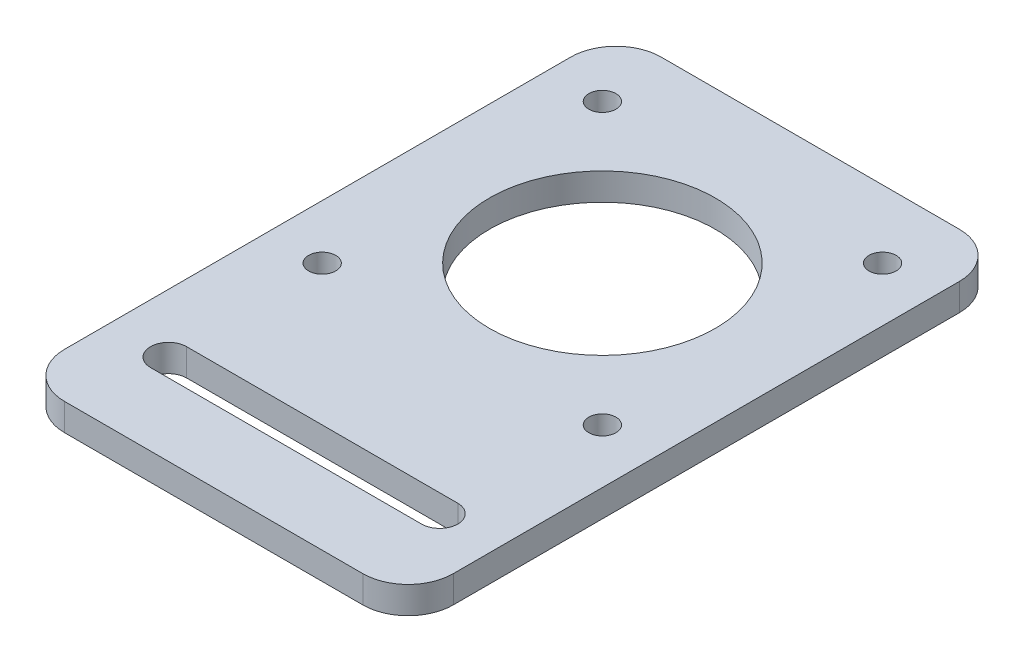
from build123d import *

# Parameters (mm, degrees)
SKETCH1_W           = 43
SKETCH1_H           = 66
BOSS_EXTRUDE1_DEPTH = 3
SKETCH2_R           = 1.5
SKETCH2_R_2         = 12.5
CUT_EXTRUDE1_DEPTH  = 40.5
FILLET1_R           = 5


with BuildPart() as part:
    # Sketch1 → Boss-Extrude1 (new body)
    with BuildSketch(Plane(origin=(0, 0, 0), x_dir=(1, 0, 0), z_dir=(0, 1, 0))):
        Rectangle(SKETCH1_W, SKETCH1_H)
    extrude(amount=BOSS_EXTRUDE1_DEPTH)

    # Sketch2 → Cut-Extrude1 (cut, through all)
    with BuildSketch(Plane(origin=(0, 3, 0), x_dir=(1, 0, 0), z_dir=(0, 1, 0))):
        with Locations(Location((15.5, 25.5, 0), (0, 0, 270))):
            Circle(SKETCH2_R)
        with Locations(Location((-15.5, 25.5, 0), (0, 0, 270))):
            Circle(SKETCH2_R)
        with Locations(Location((-15.5, -5.5, 0), (0, 0, 270))):
            Circle(SKETCH2_R)
        with Locations(Location((15.5, -5.5, 0), (0, 0, 270))):
            Circle(SKETCH2_R)
        with Locations(Location((0, 10, 0), (0, 0, 270))):
            Circle(SKETCH2_R_2)
        with BuildLine():
            Line((-15, -21), (15, -21))
            ThreePointArc((15, -21), (17, -23), (15, -25))
            Line((15, -25), (-15, -25))
            ThreePointArc((-15, -25), (-17, -23), (-15, -21))
        make_face()
    extrude(amount=-CUT_EXTRUDE1_DEPTH, mode=Mode.SUBTRACT)

    # Fillet1
    fillet1_edges = [part.edges().sort_by_distance(p)[0] for p in [
        (-21.5, 1.5, -33),
        (21.5, 1.5, -33),
        (21.5, 1.5, 33),
        (-21.5, 1.5, 33),
    ]]
    fillet(fillet1_edges, radius=FILLET1_R)


solid = part.part
